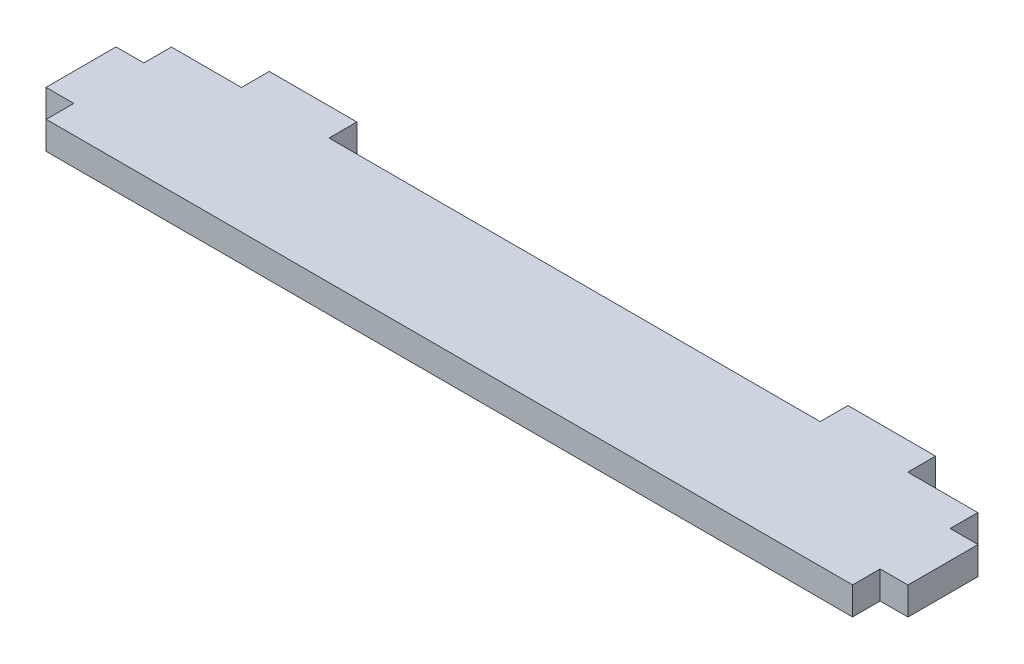
from build123d import *

# Parameters (mm, degrees)
SKETCH1_W           = 92.1
SKETCH1_H           = 14.3
BOSS_EXTRUDE1_DEPTH = 3.175
SKETCH2_W           = 10
SKETCH2_H           = 3.175
BOSS_EXTRUDE2_DEPTH = 3.175
SKETCH3_W           = 8
SKETCH3_H           = 3.175
BOSS_EXTRUDE3_DEPTH = 3.175


with BuildPart() as part:
    # Sketch1 → Boss-Extrude1 (new body)
    with BuildSketch(Plane(origin=(0, 0, 0), x_dir=(1, 0, 0), z_dir=(0, 1, 0))):
        Rectangle(SKETCH1_W, SKETCH1_H)
    extrude(amount=BOSS_EXTRUDE1_DEPTH)

    # Sketch2 → Boss-Extrude2 (add)
    with BuildSketch(Plane(origin=(0, 0, -7.15), x_dir=(-1, 0, 0), z_dir=(0, 0, -1))):
        with Locations((-33.05, 1.5875)):
            Rectangle(SKETCH2_W, SKETCH2_H)
        with Locations((33.05, 1.5875)):
            Rectangle(SKETCH2_W, SKETCH2_H)
    extrude(amount=BOSS_EXTRUDE2_DEPTH)

    # Sketch3 → Boss-Extrude3 (add)
    with BuildSketch(Plane.ZY.offset(46.05)):
        with Locations((0, 1.5875)):
            Rectangle(SKETCH3_W, SKETCH3_H)
    boss_extrude3 = extrude(amount=BOSS_EXTRUDE3_DEPTH)

    # Mirror1: Boss-Extrude3 across plane
    add(boss_extrude3.mirror(Plane(origin=(0, 0, 0), x_dir=(0, 0, 1), z_dir=(1, 0, 0))))


solid = part.part
